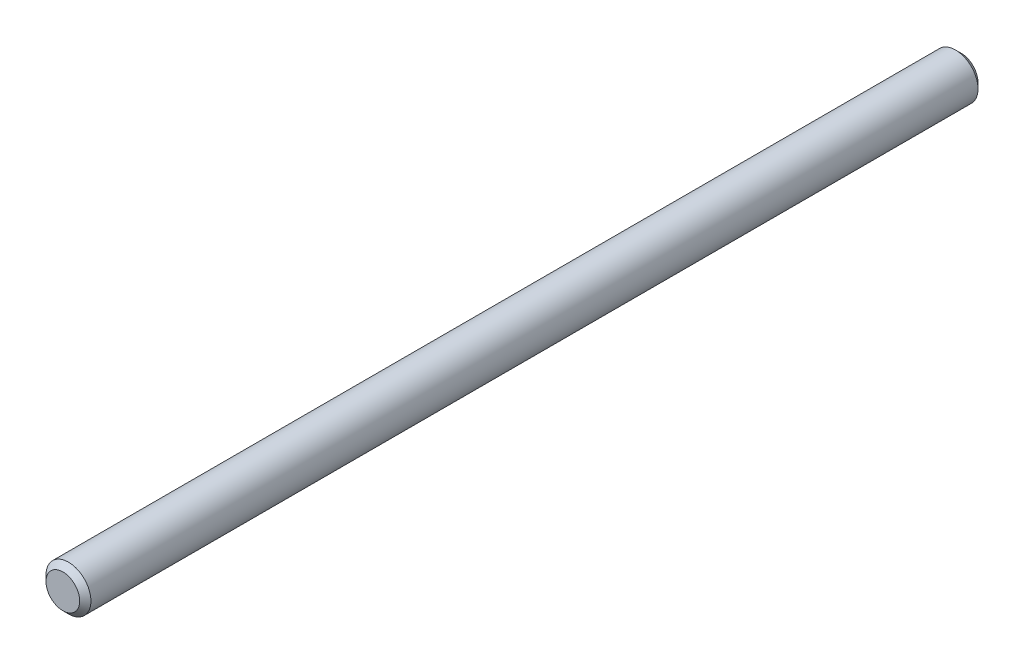
from build123d import *

# Parameters (mm, degrees)
SKETCH_1_R      = 2
EXTRUDE_1_DEPTH = 80
CHAMFER_1_SIZE  = 0.5


with BuildPart() as part:
    # 草图1 → 凸台-拉伸1 (new body)
    with BuildSketch(Plane.XY):
        Circle(SKETCH_1_R)
    extrude(amount=-EXTRUDE_1_DEPTH)

    # 倒角1
    chamfer_1_edges = [part.edges().sort_by_distance(p)[0] for p in [
        (-2, 0, 0),
        (-2, 0, -80),
    ]]
    chamfer(chamfer_1_edges, length=CHAMFER_1_SIZE)


solid = part.part
